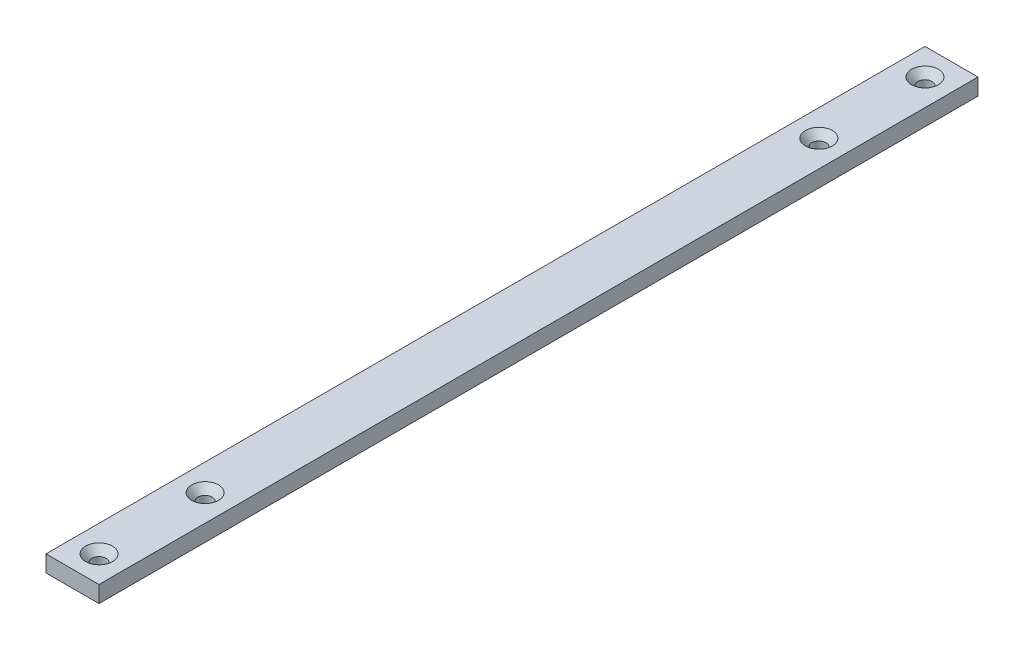
from build123d import *

# Parameters (mm, degrees)
SKETCH3_W                                        = 25.4
SKETCH3_H                                        = 7.9375
BOSS_EXTRUDE1_DEPTH                              = 210.5
CSK_FOR_1_4_FLAT_HEAD_MACHINE_SCREW1_D           = 6.7564
CSK_FOR_1_4_FLAT_HEAD_MACHINE_SCREW1_CSINK_D     = 12.8778
CSK_FOR_1_4_FLAT_HEAD_MACHINE_SCREW1_CSINK_ANGLE = 82


with BuildPart() as part:
    # Sketch3 → Boss-Extrude1 (new, symmetric)
    with BuildSketch(Plane.XY):
        Rectangle(SKETCH3_W, SKETCH3_H)
    extrude(amount=BOSS_EXTRUDE1_DEPTH, both=True)

    # CSK for 1/4 Flat Head Machine Screw1 (through all)
    with Locations(Plane(origin=(0, 3.96875, 0), x_dir=(1, 0, 0), z_dir=(0, 1, 0))):
        with Locations((0, 197.8), (0, -197.8), (0, 147), (0, -147)):
            CounterSinkHole(CSK_FOR_1_4_FLAT_HEAD_MACHINE_SCREW1_D / 2, CSK_FOR_1_4_FLAT_HEAD_MACHINE_SCREW1_CSINK_D / 2, counter_sink_angle=CSK_FOR_1_4_FLAT_HEAD_MACHINE_SCREW1_CSINK_ANGLE)


solid = part.part
